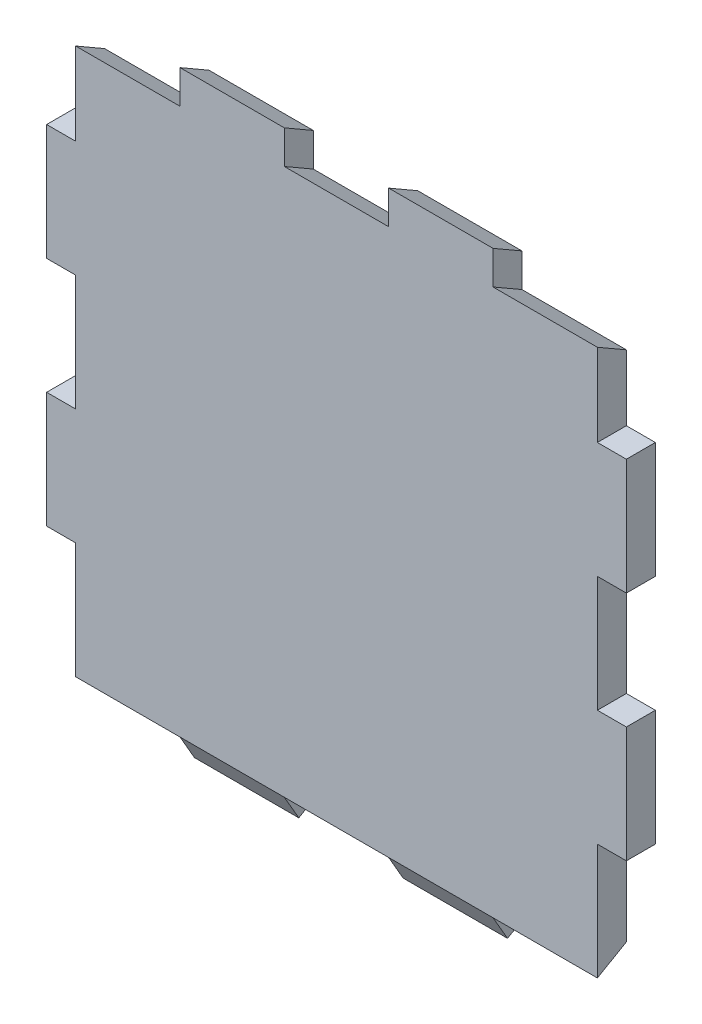
from build123d import *

# Parameters (mm, degrees)
ESQUISSE1_W             = 90
ESQUISSE1_H             = 100
BOSS_EXTRU_1_DEPTH      = 5
ENL_V_MAT_EXTRU_1_DEPTH = 135.629120178
BOSS_EXTRU_2_DEPTH      = 90
ESQUISSE10_W            = 18
ESQUISSE10_H            = 15
BOSS_EXTRU_4_DEPTH      = 5
ENL_V_MAT_EXTRU_3_DEPTH = 126.676901627
ESQUISSE12_W            = 18
ESQUISSE12_H            = 12
BOSS_EXTRU_5_DEPTH      = 5
ENL_V_MAT_EXTRU_4_DEPTH = 134.240384268
ESQUISSE14_W            = 5
ESQUISSE14_H            = 20
BOSS_EXTRU_6_DEPTH      = 5


with BuildPart() as part:
    # Esquisse1 → Boss.-Extru.1 (new body)
    with BuildSketch(Plane.XY):
        with Locations((-45, -50)):
            Rectangle(ESQUISSE1_W, ESQUISSE1_H)
    extrude(amount=BOSS_EXTRU_1_DEPTH)

    # Esquisse2 → Enlèv. mat.-Extru.1 (cut, through all)
    with BuildSketch(Plane(origin=(0, 0, 0), x_dir=(0, 0, -1), z_dir=(1, 0, 0))):
        Polygon((0, -11.547005384), (-5, -8.660254038), (-5, 0), (0, 0), align=None)
    extrude(amount=-ENL_V_MAT_EXTRU_1_DEPTH, mode=Mode.SUBTRACT)

    # Esquisse3 → Boss.-Extru.2 (add, through all)
    with BuildSketch(Plane(origin=(0, 0, 0), x_dir=(0, 0, -1), z_dir=(1, 0, 0))):
        Polygon((-5, -100), (-5, -102.886751346), (0, -100), align=None)
    extrude(amount=-BOSS_EXTRU_2_DEPTH)

    # Esquisse10 → Boss.-Extru.4 (add, through all)
    with BuildSketch(Plane(origin=(0, 0, 0), x_dir=(-1, 0, 0), z_dir=(0, 0, -1))):
        with Locations((27, -4.047005384)):
            Rectangle(ESQUISSE10_W, ESQUISSE10_H)
        with Locations((63, -4.047005384)):
            Rectangle(ESQUISSE10_W, ESQUISSE10_H)
    extrude(amount=-BOSS_EXTRU_4_DEPTH)

    # Esquisse11 → Enlèv. mat.-Extru.3 (cut, through all)
    with BuildSketch(Plane(origin=(-18, 0, 0), x_dir=(0, 0, -1), z_dir=(1, 0, 0))):
        Polygon((0, -5.773502692), (-5, -2.886751346), (-5, 3.452994616), (0, 3.452994616), align=None)
    extrude(amount=-ENL_V_MAT_EXTRU_3_DEPTH, mode=Mode.SUBTRACT)

    # Esquisse12 → Boss.-Extru.5 (add)
    with BuildSketch(Plane(origin=(0, 0, 0), x_dir=(-1, 0, 0), z_dir=(0, 0, -1))):
        with Locations((27, -106)):
            Rectangle(ESQUISSE12_W, ESQUISSE12_H)
        with Locations((63, -106)):
            Rectangle(ESQUISSE12_W, ESQUISSE12_H)
    extrude(amount=-BOSS_EXTRU_5_DEPTH)

    # Esquisse13 → Enlèv. mat.-Extru.4 (cut, through all)
    with BuildSketch(Plane(origin=(-18, 0, 0), x_dir=(0, 0, -1), z_dir=(1, 0, 0))):
        Polygon((-2.5, -107.216878365), (-5, -102.886751346), (-5, -112), (0, -112), (0, -105.773502692), align=None)
    extrude(amount=-ENL_V_MAT_EXTRU_4_DEPTH, mode=Mode.SUBTRACT)

    # Esquisse14 → Boss.-Extru.6 (add, through all)
    with BuildSketch(Plane.XY.offset(5)):
        with Locations((2.5, -32.886751346)):
            Rectangle(ESQUISSE14_W, ESQUISSE14_H)
        with Locations((2.5, -72.886751346)):
            Rectangle(ESQUISSE14_W, ESQUISSE14_H)
        with Locations((-92.5, -72.886751346)):
            Rectangle(ESQUISSE14_W, ESQUISSE14_H)
        with Locations((-92.5, -32.886751346)):
            Rectangle(ESQUISSE14_W, ESQUISSE14_H)
    extrude(amount=-BOSS_EXTRU_6_DEPTH)


solid = part.part
